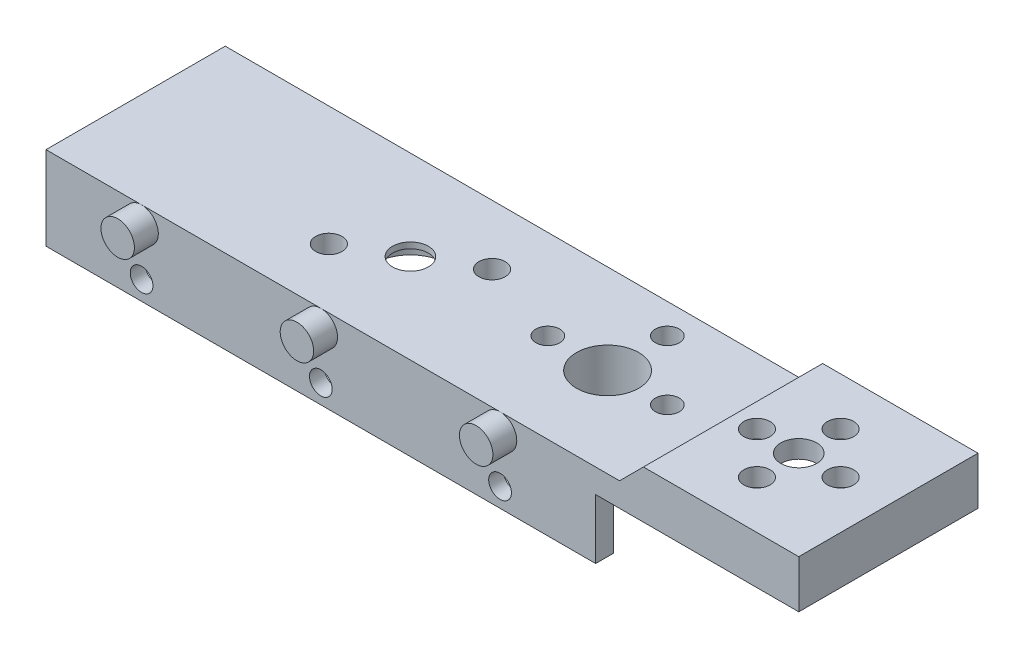
from build123d import *
from build123d.topology import SkipClean

# Parameters (mm, degrees)
SKETCH_1_W          = 63
SKETCH_1_H          = 15
SKETCH_1_R          = 1.5
SKETCH_1_R_2        = 1.1
SKETCH_1_R_3        = 2.6
SKETCH_1_R_4        = 1
EXTRUDE_1_DEPTH     = 2
SKETCH_2_R          = 1.4
EXTRUDE_2_DEPTH     = 2
SKETCH_3_R          = 3
CUT_EXTRUDE_1_DEPTH = 1.5
SKETCH_4_W          = 46
SKETCH_4_H          = 1.5
EXTRUDE_3_DEPTH     = 5
SKETCH_2_3_R        = 0.95
CUT_EXTRUDE_2_DEPTH = 1.5
CUT_EXTRUDE_3_DEPTH = 0.25
SKETCH_1_7_W        = 15
SKETCH_1_7_H        = 15
SKETCH_1_7_R        = 1.5
SKETCH_1_7_R_2      = 1.1
EXTRUDE_4_DEPTH     = 4
SKETCH_1_8_R        = 6
SKETCH_1_8_R_2      = 1.5
SKETCH_1_8_R_3      = 1.1
CUT_EXTRUDE_4_DEPTH = 2.5
CUT_EXTRUDE_5_DEPTH = 15
EXTRUDE_START       = 2
SKETCH_8_R          = 3.6
SKETCH_8_R_2        = 2.6
EXTRUDE_5_DEPTH     = 2


with BuildPart() as part:
    # 草图1 → 凸台-拉伸1 (new body)
    with BuildSketch(Plane(origin=(0, 0, 0), x_dir=(1, 0, 0), z_dir=(0, 1, 0))):
        Rectangle(SKETCH_1_W, SKETCH_1_H)
        with Locations(Location((-8.5, 0, 0), (0, 0, 270))):
            Circle(SKETCH_1_R, mode=Mode.SUBTRACT)
        with Locations(Location((-4.169872981, 2.5, 0), (0, 0, 270))):
            Circle(SKETCH_1_R_2, mode=Mode.SUBTRACT)
        with Locations(Location((-12.830127019, -2.5, 0), (0, 0, 270))):
            Circle(SKETCH_1_R_2, mode=Mode.SUBTRACT)
        with Locations(Location((8, 0, 0), (0, 0, 270))):
            Circle(SKETCH_1_R_3, mode=Mode.SUBTRACT)
        with Locations(Location((24, 0, 0), (0, 0, 270))):
            Circle(SKETCH_1_R, mode=Mode.SUBTRACT)
        with Locations(Location((27.5, 0, 0), (0, 0, 270))):
            Circle(SKETCH_1_R_2, mode=Mode.SUBTRACT)
        with Locations(Location((24, -3.5, 0), (0, 0, 270))):
            Circle(SKETCH_1_R_2, mode=Mode.SUBTRACT)
        with Locations(Location((20.5, 0, 0), (0, 0, 270))):
            Circle(SKETCH_1_R_2, mode=Mode.SUBTRACT)
        with Locations(Location((24, 3.5, 0), (0, 0, 270))):
            Circle(SKETCH_1_R_2, mode=Mode.SUBTRACT)
        with Locations(Location((13, 0, 0), (0, 0, 270))):
            Circle(SKETCH_1_R_4, mode=Mode.SUBTRACT)
        with Locations(Location((3, 0, 0), (0, 0, 270))):
            Circle(SKETCH_1_R_4, mode=Mode.SUBTRACT)
        with Locations(Location((8, 5, 0), (0, 0, 270))):
            Circle(SKETCH_1_R_4, mode=Mode.SUBTRACT)
    extrude(amount=EXTRUDE_1_DEPTH)

    # 草图2 → 凸台-拉伸2 (add)
    with BuildSketch(Plane.XY.offset(7.5)):
        with Locations(Location((-23.5, 0.6, 0), (0, 0, 205.376933525))):
            Circle(SKETCH_2_R)
        with Locations(Location((-8.5, 0.6, 0), (0, 0, 205.376933525))):
            Circle(SKETCH_2_R)
        with Locations(Location((6.5, 0.6, 0), (0, 0, 205.376933525))):
            Circle(SKETCH_2_R)
    extrude(amount=EXTRUDE_2_DEPTH)

    # 草图3 → 切除-拉伸1 (cut)
    with BuildSketch(Plane.XZ):
        with Locations(Location((-8.5, 0, 0), (0, 0, 270))):
            Circle(SKETCH_3_R)
    extrude(amount=-CUT_EXTRUDE_1_DEPTH, mode=Mode.SUBTRACT)

    # 草图4 → 凸台-拉伸3 (add)
    with BuildSketch(Plane.XZ):
        with Locations((-8.5, 6.75)):
            Rectangle(SKETCH_4_W, SKETCH_4_H)
    extrude(amount=EXTRUDE_3_DEPTH)

    # 草图2<3> → 切除-拉伸2 (cut)
    with BuildSketch(Plane.XY.offset(7.5)):
        with Locations((-23.5, -3.4)):
            Circle(SKETCH_2_3_R)
        with Locations((-8.5, -3.4)):
            Circle(SKETCH_2_3_R)
        with Locations((6.5, -3.4)):
            Circle(SKETCH_2_3_R)
    extrude(amount=-CUT_EXTRUDE_2_DEPTH, mode=Mode.SUBTRACT)

    # 草图5 → 切除-拉伸3 (cut)
    with BuildSketch(Plane(origin=(0, 0, 6), x_dir=(-1, 0, 0), z_dir=(0, 0, -1))):
        Polygon((22.403034489, -1.5), (24.596965511, -1.5), (25.693931023, -3.4), (24.596965511, -5.3), (22.403034489, -5.3), (21.306068977, -3.4), align=None)
        Polygon((6.306068977, -3.4), (7.403034489, -1.5), (9.596965511, -1.5), (10.693931023, -3.4), (9.596965511, -5.3), (7.403034489, -5.3), align=None)
        Polygon((-8.693931023, -3.4), (-7.596965511, -1.5), (-5.403034489, -1.5), (-4.306068977, -3.4), (-5.403034489, -5.3), (-7.596965511, -5.3), align=None)
    extrude(amount=-CUT_EXTRUDE_3_DEPTH, mode=Mode.SUBTRACT)

    # 草图1<7> → 凸台-拉伸4 (add)
    with SkipClean():  # the faces are left unmerged after this step: merging them gives an invalid solid
        with BuildSketch(Plane(origin=(0, 0, 0), x_dir=(1, 0, 0), z_dir=(0, 1, 0))):
            with Locations((24, 0)):
                Rectangle(SKETCH_1_7_W, SKETCH_1_7_H)
            with Locations(Location((24, 0, 0), (0, 0, 270))):
                Circle(SKETCH_1_7_R, mode=Mode.SUBTRACT)
            with Locations(Location((27.5, 0, 0), (0, 0, 270))):
                Circle(SKETCH_1_7_R_2, mode=Mode.SUBTRACT)
            with Locations(Location((24, -3.5, 0), (0, 0, 270))):
                Circle(SKETCH_1_7_R_2, mode=Mode.SUBTRACT)
            with Locations(Location((20.5, 0, 0), (0, 0, 270))):
                Circle(SKETCH_1_7_R_2, mode=Mode.SUBTRACT)
            with Locations(Location((24, 3.5, 0), (0, 0, 270))):
                Circle(SKETCH_1_7_R_2, mode=Mode.SUBTRACT)
        extrude(amount=EXTRUDE_4_DEPTH)

    # 草图1<8> → 切除-拉伸4 (cut)
    with SkipClean():  # the faces are left unmerged after this step: merging them gives an invalid solid
        with BuildSketch(Plane(origin=(0, 0, 0), x_dir=(1, 0, 0), z_dir=(0, 1, 0))):
            with Locations(Location((24, 0, 0), (0, 0, 270))):
                Circle(SKETCH_1_8_R)
            with Locations(Location((24, 0, 0), (0, 0, 270))):
                Circle(SKETCH_1_8_R_2, mode=Mode.SUBTRACT)
            with Locations(Location((27.5, 0, 0), (0, 0, 270))):
                Circle(SKETCH_1_8_R_3, mode=Mode.SUBTRACT)
            with Locations(Location((24, -3.5, 0), (0, 0, 270))):
                Circle(SKETCH_1_8_R_3, mode=Mode.SUBTRACT)
            with Locations(Location((20.5, 0, 0), (0, 0, 270))):
                Circle(SKETCH_1_8_R_3, mode=Mode.SUBTRACT)
            with Locations(Location((24, 3.5, 0), (0, 0, 270))):
                Circle(SKETCH_1_8_R_3, mode=Mode.SUBTRACT)
        extrude(amount=CUT_EXTRUDE_4_DEPTH, mode=Mode.SUBTRACT)

    # 草图6 → 切除-拉伸5 (cut)
    with BuildSketch(Plane(origin=(0, 0, -7.5), x_dir=(-1, 0, 0), z_dir=(0, 0, -1))):
        Polygon((-16.5, 2), (-18.5, 4), (-16.5, 4), align=None)
    extrude(amount=-CUT_EXTRUDE_5_DEPTH, mode=Mode.SUBTRACT)

    # 草图8 → 凸台-拉伸5 (add)
    with SkipClean():  # the faces are left unmerged after this step: merging them gives an invalid solid
        with BuildSketch(Plane.XZ.offset(EXTRUDE_START)):
            with Locations(Location((8, 0, 0), (0, 0, 90))):
                Circle(SKETCH_8_R)
            with Locations(Location((8, 0, 0), (0, 0, 270))):
                Circle(SKETCH_8_R_2, mode=Mode.SUBTRACT)
        extrude(amount=-EXTRUDE_5_DEPTH)


solid = part.part
